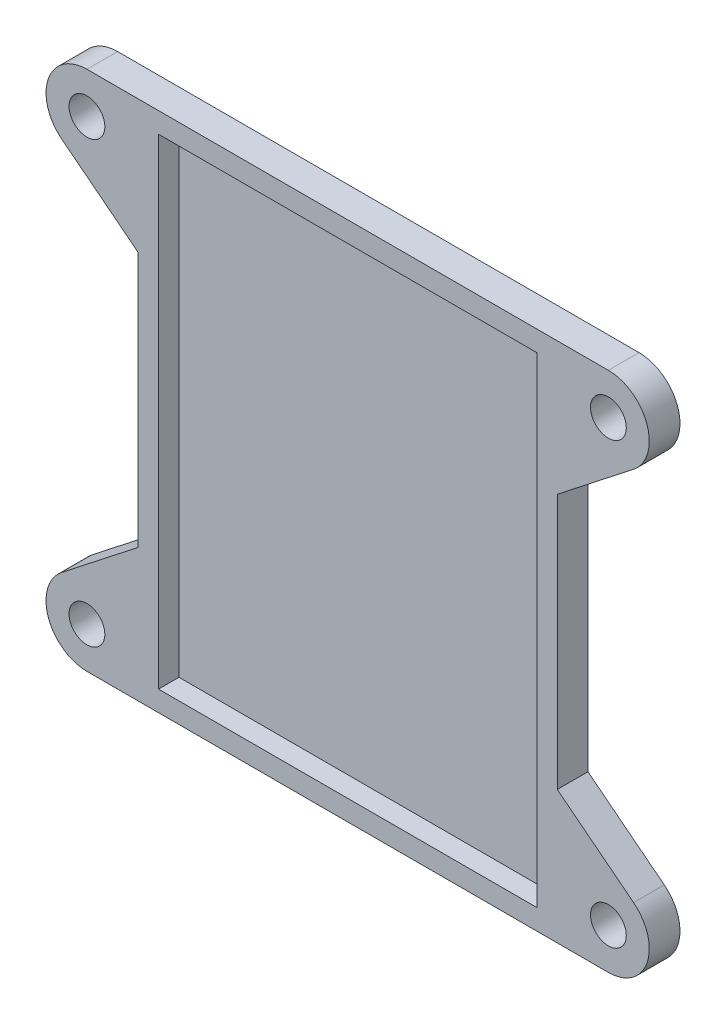
from build123d import *

# Parameters (mm, degrees)
SKETCH1_W                                  = 41
SKETCH1_H                                  = 51
BOSS_EXTRUDE1_DEPTH                        = 3
SKETCH2_W                                  = 37
SKETCH2_H                                  = 47
CUT_EXTRUDE1_DEPTH                         = 2
SKETCH4_R                                  = 1.75
BOSS_EXTRUDE2_DEPTH                        = 3
MIRROR1_AT_THE_SECOND_PLANE_COPY_1_SKETC_R = 1.75
MIRROR1_AT_THE_SECOND_PLANE_COPY_1_DEPTH   = 3


with BuildPart() as part:
    # Sketch1 → Boss-Extrude1 (new body)
    with BuildSketch(Plane.XY):
        Rectangle(SKETCH1_W, SKETCH1_H)
    extrude(amount=BOSS_EXTRUDE1_DEPTH)

    # Sketch2 → Cut-Extrude1 (cut)
    with BuildSketch(Plane.XY.offset(3)):
        Rectangle(SKETCH2_W, SKETCH2_H)
    extrude(amount=-CUT_EXTRUDE1_DEPTH, mode=Mode.SUBTRACT)

    # Sketch4 → Boss-Extrude2 (add)
    with BuildSketch(Plane.XY):
        with BuildLine():
            Line((25.5, 25.5), (20.5, 25.5))
            Line((20.5, 25.5), (20.5, 12.5))
            Line((20.5, 12.5), (27.967226295, 18.351540947))
            ThreePointArc((27.967226295, 18.351540947), (29.281126566, 22.805021798), (25.5, 25.5))
        make_face()
        with Locations((25.5, 21.5)):
            Circle(SKETCH4_R, mode=Mode.SUBTRACT)
    boss_extrude2 = extrude(amount=BOSS_EXTRUDE2_DEPTH)

    # Mirror1: Boss-Extrude2 across plane
    add(boss_extrude2.mirror(Plane(origin=(0, 0, 0), x_dir=(0, 0, 1), z_dir=(1, 0, 0))))

    # Mirror1 at the second plane: Boss-Extrude2 across plane
    add(boss_extrude2.mirror(Plane.ZX))

    # Mirror1 at the second plane copy 1 sketc → Mirror1 at the second plane copy 1 (add)
    with BuildSketch(Plane(origin=(0, 0, 0), x_dir=(-1, 0, 0), z_dir=(0, 0, 1))):
        with BuildLine():
            Line((25.5, 25.5), (20.5, 25.5))
            Line((20.5, 25.5), (20.5, 12.5))
            Line((20.5, 12.5), (27.967226295, 18.351540947))
            ThreePointArc((27.967226295, 18.351540947), (29.281126566, 22.805021798), (25.5, 25.5))
        make_face()
        with Locations((25.5, 21.5)):
            Circle(MIRROR1_AT_THE_SECOND_PLANE_COPY_1_SKETC_R, mode=Mode.SUBTRACT)
    extrude(amount=MIRROR1_AT_THE_SECOND_PLANE_COPY_1_DEPTH)


solid = part.part
